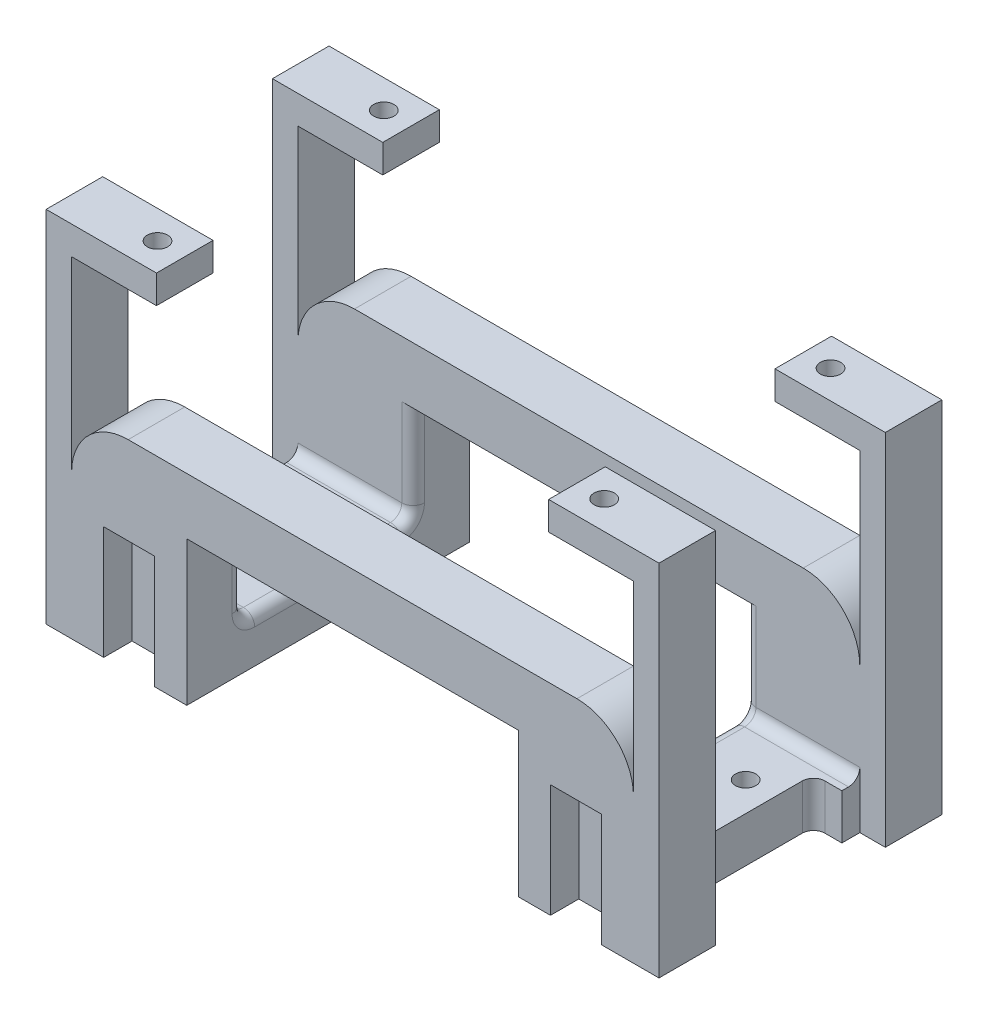
from build123d import *

# Parameters (mm, degrees)
BOSS_EXTRUDE1_DEPTH = 10
SKETCH2_W           = 20.36
SKETCH2_H           = 8
BOSS_EXTRUDE2_DEPTH = 30
BOSS_EXTRUDE3_DEPTH = 10
SKETCH4_R           = 1.8
CUT_EXTRUDE1_DEPTH  = 90.301874976
CUT_EXTRUDE2_DEPTH  = 90.301874976
FILLET2_R           = 10
FILLET3_R           = 2
FILLET4_R           = 2
SKETCH6_W           = 9
SKETCH6_H           = 20
CUT_EXTRUDE3_DEPTH  = 5
SKETCH7_W           = 9
SKETCH7_H           = 20
CUT_EXTRUDE4_DEPTH  = 5
SKETCH8_W           = 10
SKETCH8_H           = 63.5
BOSS_EXTRUDE4_DEPTH = 4.5
SKETCH9_W           = 10
SKETCH9_H           = 5
BOSS_EXTRUDE5_DEPTH = 15
SKETCH10_W          = 10
SKETCH10_H          = 63.5
BOSS_EXTRUDE6_DEPTH = 4.5
SKETCH11_W          = 10
SKETCH11_H          = 5
BOSS_EXTRUDE7_DEPTH = 15
SKETCH12_R          = 1.8
CUT_EXTRUDE5_DEPTH  = 5


with BuildPart() as part:
    # Sketch1 → Boss-Extrude1 (new body)
    with BuildSketch(Plane.XY):
        Polygon((-68.691883613, -39.730446699), (-48.331883613, -39.730446699), (-48.331883613, -14.230446699), (10.268116387, -14.230446699), (10.268116387, -39.730446699), (30.628116387, -39.730446699), (30.628116387, -4.230446699), (-68.691883613, -4.230446699), align=None)
    extrude(amount=BOSS_EXTRUDE1_DEPTH)

    # Sketch2 → Boss-Extrude2 (add)
    with BuildSketch(Plane.XY.offset(10)):
        with Locations((-58.511883613, -35.730446699)):
            Rectangle(SKETCH2_W, SKETCH2_H)
        with Locations((20.448116387, -35.730446699)):
            Rectangle(SKETCH2_W, SKETCH2_H)
    extrude(amount=BOSS_EXTRUDE2_DEPTH)

    # Sketch3 → Boss-Extrude3 (add)
    with BuildSketch(Plane.XY.offset(40)):
        Polygon((-68.691883613, -39.730446699), (-68.691883613, -4.230446699), (30.628116387, -4.230446699), (30.628116387, -39.730446699), (10.268116387, -39.730446699), (10.268116387, -14.230446699), (-48.331883613, -14.230446699), (-48.331883613, -39.730446699), align=None)
    extrude(amount=BOSS_EXTRUDE3_DEPTH)

    # Sketch4 → Cut-Extrude1 (cut, through all)
    with BuildSketch(Plane(origin=(0, -31.730446699, 0), x_dir=(1, 0, 0), z_dir=(0, 1, 0))):
        with Locations(Location((-58.511883613, -20, 0), (0, 0, 270))):
            Circle(SKETCH4_R)
        with Locations(Location((-58.511883613, -30, 0), (0, 0, 270))):
            Circle(SKETCH4_R)
        with Locations(Location((20.448116387, -30, 0), (0, 0, 270))):
            Circle(SKETCH4_R)
        with Locations(Location((20.448116387, -20, 0), (0, 0, 270))):
            Circle(SKETCH4_R)
    extrude(amount=-CUT_EXTRUDE1_DEPTH, mode=Mode.SUBTRACT)

    # Sketch5 → Cut-Extrude2 (cut, through all)
    with BuildSketch(Plane(origin=(0, -31.730446699, 0), x_dir=(1, 0, 0), z_dir=(0, 1, 0))):
        with BuildLine():
            Line((-68.691883613, -13.5), (-65.691883613, -13.5))
            ThreePointArc((-65.691883613, -13.5), (-64.277670051, -14.085786438), (-63.691883613, -15.5))
            Line((-63.691883613, -15.5), (-63.691883613, -34.5))
            ThreePointArc((-63.691883613, -34.5), (-64.277670051, -35.914213562), (-65.691883613, -36.5))
            Line((-65.691883613, -36.5), (-68.691883613, -36.5))
            Line((-68.691883613, -36.5), (-68.691883613, -13.5))
        make_face()
        with BuildLine():
            Line((30.628116387, -13.174954518), (27.628116387, -13.174954518))
            ThreePointArc((27.628116387, -13.174954518), (26.213902825, -13.760740955), (25.628116387, -15.174954518))
            Line((25.628116387, -15.174954518), (25.628116387, -34.174954518))
            ThreePointArc((25.628116387, -34.174954518), (26.213902825, -35.58916808), (27.628116387, -36.174954518))
            Line((27.628116387, -36.174954518), (30.628116387, -36.174954518))
            Line((30.628116387, -36.174954518), (30.628116387, -13.174954518))
        make_face()
    extrude(amount=-CUT_EXTRUDE2_DEPTH, mode=Mode.SUBTRACT)

    # Fillet2
    fillet2_edges = [part.edges().sort_by_distance(p)[0] for p in [
        (30.628116387, -4.230446699, 5),
        (30.628116387, -4.230446699, 45),
        (-68.691883613, -4.230446699, 5),
        (-68.691883613, -4.230446699, 45),
    ]]
    fillet(fillet2_edges, radius=FILLET2_R)

    # Fillet3
    fillet3_edges = [part.edges().sort_by_distance(p)[0] for p in [
        (20.448116387, -31.730446699, 40),
        (-58.511883613, -31.730446699, 40),
        (20.448116387, -31.730446699, 10),
        (-58.511883613, -31.730446699, 10),
    ]]
    fillet(fillet3_edges, radius=FILLET3_R)

    # Fillet4
    fillet4_edges = [part.edges().sort_by_distance(p)[0] for p in [
        (10.268116387, -21.980446699, 10),
        (-48.331883613, -21.980446699, 40),
        (10.268116387, -31.730446699, 25),
        (-48.331883613, -31.730446699, 25),
        (-48.331883613, -21.980446699, 10),
        (10.268116387, -31.144660261, 39.414213562),
        (-48.331883613, -31.144660261, 39.414213562),
        (10.268116387, -31.144660261, 10.585786438),
        (-48.331883613, -31.144660261, 10.585786438),
        (10.268116387, -21.980446699, 40),
    ]]
    fillet(fillet4_edges, radius=FILLET4_R)

    # Sketch6 → Cut-Extrude3 (cut)
    with BuildSketch(Plane.XY.offset(50)):
        with Locations((-58.511883613, -29.730446699)):
            Rectangle(SKETCH6_W, SKETCH6_H)
        with Locations((20.448116387, -29.730446699)):
            Rectangle(SKETCH6_W, SKETCH6_H)
    extrude(amount=-CUT_EXTRUDE3_DEPTH, mode=Mode.SUBTRACT)

    # Sketch7 → Cut-Extrude4 (cut)
    with BuildSketch(Plane(origin=(0, 0, 0), x_dir=(-1, 0, 0), z_dir=(0, 0, -1))):
        with Locations((-20.448116387, -29.730446699)):
            Rectangle(SKETCH7_W, SKETCH7_H)
        with Locations((58.511883613, -29.730446699)):
            Rectangle(SKETCH7_W, SKETCH7_H)
    extrude(amount=-CUT_EXTRUDE4_DEPTH, mode=Mode.SUBTRACT)

    # Sketch8 → Boss-Extrude4 (add)
    with BuildSketch(Plane(origin=(30.628116387, 0, 0), x_dir=(0, 0, -1), z_dir=(1, 0, 0))):
        with Locations((-45, -7.980446699)):
            Rectangle(SKETCH8_W, SKETCH8_H)
        with Locations((-5, -7.980446699)):
            Rectangle(SKETCH8_W, SKETCH8_H)
    extrude(amount=BOSS_EXTRUDE4_DEPTH)

    # Sketch9 → Boss-Extrude5 (add)
    with BuildSketch(Plane.ZY.offset(-30.628116387)):
        with Locations((5, 21.269553301)):
            Rectangle(SKETCH9_W, SKETCH9_H)
        with Locations((45, 21.269553301)):
            Rectangle(SKETCH9_W, SKETCH9_H)
    extrude(amount=BOSS_EXTRUDE5_DEPTH)

    # Sketch10 → Boss-Extrude6 (add)
    with BuildSketch(Plane.ZY.offset(68.691883613)):
        with Locations((5, -7.980446699)):
            Rectangle(SKETCH10_W, SKETCH10_H)
        with Locations((45, -7.980446699)):
            Rectangle(SKETCH10_W, SKETCH10_H)
    extrude(amount=BOSS_EXTRUDE6_DEPTH)

    # Sketch11 → Boss-Extrude7 (add)
    with BuildSketch(Plane(origin=(-68.691883613, 0, 0), x_dir=(0, 0, -1), z_dir=(1, 0, 0))):
        with Locations((-45, 21.269553301)):
            Rectangle(SKETCH11_W, SKETCH11_H)
        with Locations((-5, 21.269553301)):
            Rectangle(SKETCH11_W, SKETCH11_H)
    extrude(amount=BOSS_EXTRUDE7_DEPTH)

    # Sketch12 → Cut-Extrude5 (cut)
    with BuildSketch(Plane(origin=(0, 23.769553301, 0), x_dir=(1, 0, 0), z_dir=(0, 1, 0))):
        with Locations(Location((20.448116387, -45, 0), (0, 0, 270))):
            Circle(SKETCH12_R)
        with Locations(Location((20.448116387, -5, 0), (0, 0, 270))):
            Circle(SKETCH12_R)
        with Locations(Location((-58.511883613, -45, 0), (0, 0, 270))):
            Circle(SKETCH12_R)
        with Locations(Location((-58.511883613, -5, 0), (0, 0, 270))):
            Circle(SKETCH12_R)
    extrude(amount=-CUT_EXTRUDE5_DEPTH, mode=Mode.SUBTRACT)


solid = part.part
